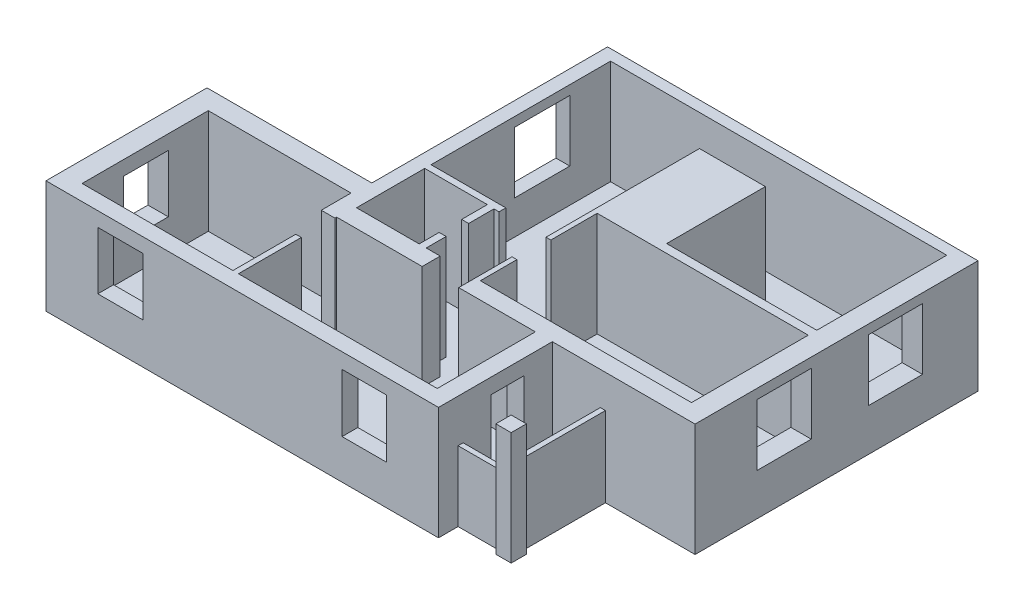
from build123d import *

# Parameters (mm, degrees)
EXTRUDE_1_DEPTH     = 2460
EXTRUDE_2_DEPTH     = 200
CUT_EXTRUDE_1_REACH = 12467.233
SKETCH_3_W          = 1010
SKETCH_3_H          = 1011.258012307
CUT_EXTRUDE_2_REACH = 14095.577
SKETCH_4_W          = 1980
SKETCH_4_H          = 778.873385884
SKETCH_5_W          = 780
SKETCH_5_H          = 360
EXTRUDE_3_DEPTH     = 400
CUT_EXTRUDE_3_REACH = 12799.001
SKETCH_6_W          = 1050
SKETCH_6_H          = 1370
SKETCH_6_W_2        = 1060
SKETCH_6_H_2        = 1355
CUT_EXTRUDE_4_REACH = 15729.327
SKETCH_7_W          = 1055
SKETCH_7_H          = 1355
CUT_EXTRUDE_5_REACH = 12832.714
SKETCH_8_W          = 1300
SKETCH_8_H          = 1440
CUT_EXTRUDE_6_REACH = 15729.327
SKETCH_9_W          = 1280
SKETCH_9_H          = 1445
SKETCH_9_W_2        = 1270


with BuildPart() as part:
    # Эскиз1 → Бобышка-Вытянуть1 (new body)
    with BuildSketch(Plane(origin=(0, 0, 0), x_dir=(1, 0, 0), z_dir=(0, 1, 0))):
        Polygon((6045, -8625), (6045, -8745), (6405, -8745), (6405, -8385), (6285, -8385), (6285, -6405), (8395, -6405), (8395, 255), (-325, 255), (-325, -5295), (-4205, -5295), (-4205, -9085), (5035, -9085), (5035, -8625), align=None)
        Polygon((0, 0), (7823.261739164, 0), (7915, 0), (7915, -3060), (4380, -3060), (4380, -735.975609756), (4230, -735.975609756), (3000, -735.975609756), (2830, -735.975609756), (2830, -4350), (2945, -4350), (2945, -3260), (7915, -3260), (7915, -6010), (2945, -6010), (2945, -5150), (2830, -5150), (2830, -6010), (2830, -6405), (4635, -6405), (4635, -7075), (5035, -7075), (5035, -6405), (6165, -6405), (6165, -8385), (6045, -8385), (6045, -8505), (5035, -8505), (5035, -7855), (4635, -7855), (4635, -8715), (-45, -8715), (-45, -7235), (-175, -7235), (-175, -8715), (-3725, -8715), (-3725, -5745), (-365, -5745), (-365, -6445), (-45, -6445), (-45, -6405), (1970, -6405), (1970, -5980), (1640, -5980), (1640, -5510), (1475, -5510), (1475, -5980), (0, -5980), (0, -4375), (1475, -4375), (1475, -4980), (1640, -4980), (1640, -4385), (1760, -4385), (1760, -4225), (0, -4225), align=None, mode=Mode.SUBTRACT)
    extrude(amount=EXTRUDE_1_DEPTH)

    # Эскиз2 → Бобышка-Вытянуть2 (add)
    with BuildSketch(Plane.XZ):
        Polygon((-4205, 5295), (-4205, 9085), (5035, 9085), (5035, 8625), (6045, 8625), (6045, 8745), (6405, 8745), (6405, 8385), (6285, 8385), (6285, 6405), (8395, 6405), (8395, -255), (-325, -255), (-325, 5295), align=None)
    extrude(amount=EXTRUDE_2_DEPTH)

    # Эскиз3 → Вырез-Вытянуть1 (cut, up to next)
    with BuildSketch(Plane.XY.offset(8625), mode=Mode.PRIVATE) as cut_extrude_1_sk1:
        with Locations((5540, 1954.370993846)):
            Rectangle(SKETCH_3_W, SKETCH_3_H)
    cut_extrude_1_tool1 = extrude(cut_extrude_1_sk1.sketch, amount=-CUT_EXTRUDE_1_REACH, mode=Mode.PRIVATE) & part.part
    add(cut_extrude_1_tool1.solids().sort_by_distance((5540, 1954.370994, 8625))[0], mode=Mode.SUBTRACT)

    # Эскиз4 → Вырез-Вытянуть2 (cut, up to next)
    with BuildSketch(Plane(origin=(6285, 0, 0), x_dir=(0, 0, -1), z_dir=(1, 0, 0)), mode=Mode.PRIVATE) as cut_extrude_2_sk1:
        with Locations((-7395, 2070.563307058)):
            Rectangle(SKETCH_4_W, SKETCH_4_H)
    cut_extrude_2_tool1 = extrude(cut_extrude_2_sk1.sketch, amount=-CUT_EXTRUDE_2_REACH, mode=Mode.PRIVATE) & part.part
    add(cut_extrude_2_tool1.solids().sort_by_distance((6285, 2070.563307, 7395))[0], mode=Mode.SUBTRACT)

    # Эскиз5 → Бобышка-Вытянуть3 (add)
    with BuildSketch(Plane(origin=(5035, 0, 0), x_dir=(0, 0, -1), z_dir=(1, 0, 0))):
        with Locations((-7465, 2280)):
            Rectangle(SKETCH_5_W, SKETCH_5_H)
    extrude(amount=-EXTRUDE_3_DEPTH)

    # Эскиз6 → Вырез-Вытянуть3 (cut, up to next)
    with BuildSketch(Plane.XY.offset(9085), mode=Mode.PRIVATE) as cut_extrude_3_sk1:
        with Locations((3290, 1415)):
            Rectangle(SKETCH_6_W, SKETCH_6_H)
    cut_extrude_3_tool1 = extrude(cut_extrude_3_sk1.sketch, amount=-CUT_EXTRUDE_3_REACH, mode=Mode.PRIVATE) & part.part
    # Эскиз6 → Вырез-Вытянуть3 (cut, up to next)
    with BuildSketch(Plane.XY.offset(9085), mode=Mode.PRIVATE) as cut_extrude_3_sk2:
        with Locations((-2455, 1442.5)):
            Rectangle(SKETCH_6_W_2, SKETCH_6_H_2)
    cut_extrude_3_tool2 = extrude(cut_extrude_3_sk2.sketch, amount=-CUT_EXTRUDE_3_REACH, mode=Mode.PRIVATE) & part.part
    add(cut_extrude_3_tool1.solids().sort_by_distance((3290, 1415, 9085))[0], mode=Mode.SUBTRACT)
    add(cut_extrude_3_tool2.solids().sort_by_distance((-2455, 1442.5, 9085))[0], mode=Mode.SUBTRACT)

    # Эскиз7 → Вырез-Вытянуть4 (cut, up to next)
    with BuildSketch(Plane.ZY.offset(4205), mode=Mode.PRIVATE) as cut_extrude_4_sk1:
        with Locations((7212.5, 1442.5)):
            Rectangle(SKETCH_7_W, SKETCH_7_H)
    cut_extrude_4_tool1 = extrude(cut_extrude_4_sk1.sketch, amount=-CUT_EXTRUDE_4_REACH, mode=Mode.PRIVATE) & part.part
    add(cut_extrude_4_tool1.solids().sort_by_distance((-4205, 1442.5, 7212.5))[0], mode=Mode.SUBTRACT)

    # Эскиз8 → Вырез-Вытянуть5 (cut, up to next)
    with BuildSketch(Plane.ZY.offset(325), mode=Mode.PRIVATE) as cut_extrude_5_sk1:
        with Locations((1610, 1520)):
            Rectangle(SKETCH_8_W, SKETCH_8_H)
    cut_extrude_5_tool1 = extrude(cut_extrude_5_sk1.sketch, amount=-CUT_EXTRUDE_5_REACH, mode=Mode.PRIVATE) & part.part
    add(cut_extrude_5_tool1.solids().sort_by_distance((-325, 1520, 1610))[0], mode=Mode.SUBTRACT)

    # Эскиз9 → Вырез-Вытянуть6 (cut, up to next)
    with BuildSketch(Plane(origin=(8395, 0, 0), x_dir=(0, 0, -1), z_dir=(1, 0, 0)), mode=Mode.PRIVATE) as cut_extrude_6_sk1:
        with Locations((-4310, 1507.5)):
            Rectangle(SKETCH_9_W, SKETCH_9_H)
    cut_extrude_6_tool1 = extrude(cut_extrude_6_sk1.sketch, amount=-CUT_EXTRUDE_6_REACH, mode=Mode.PRIVATE) & part.part
    # Эскиз9 → Вырез-Вытянуть6 (cut, up to next)
    with BuildSketch(Plane(origin=(8395, 0, 0), x_dir=(0, 0, -1), z_dir=(1, 0, 0)), mode=Mode.PRIVATE) as cut_extrude_6_sk2:
        with Locations((-1685, 1517.5)):
            Rectangle(SKETCH_9_W_2, SKETCH_9_H)
    cut_extrude_6_tool2 = extrude(cut_extrude_6_sk2.sketch, amount=-CUT_EXTRUDE_6_REACH, mode=Mode.PRIVATE) & part.part
    add(cut_extrude_6_tool1.solids().sort_by_distance((8395, 1507.5, 4310))[0], mode=Mode.SUBTRACT)
    add(cut_extrude_6_tool2.solids().sort_by_distance((8395, 1517.5, 1685))[0], mode=Mode.SUBTRACT)


solid = part.part
